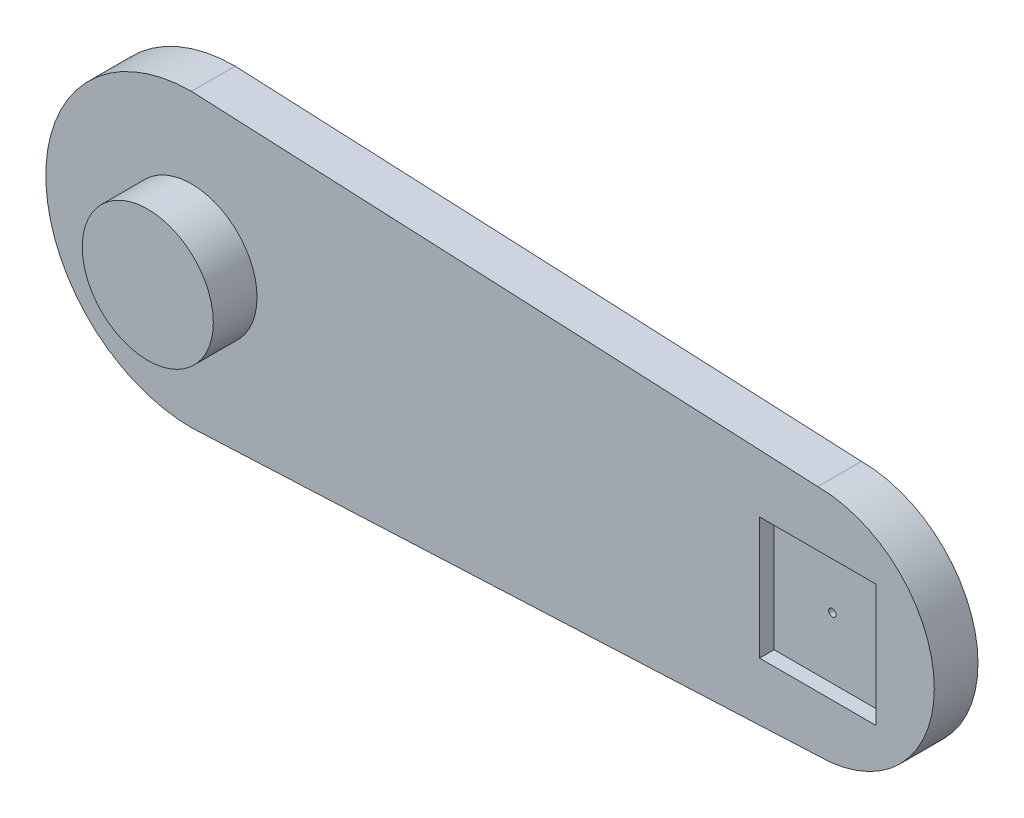
from build123d import *

# Parameters (mm, degrees)
CROQUIS1_R              = 1.25
SALIENTE_EXTRUIR1_DEPTH = 15
CROQUIS4_R              = 22.5
SALIENTE_EXTRUIR2_DEPTH = 15
CROQUIS5_R              = 11
CORTAR_EXTRUIR1_DEPTH   = 5
CROQUIS6_W              = 40
CROQUIS6_H              = 42
CORTAR_EXTRUIR2_DEPTH   = 5


with BuildPart() as part:
    # Croquis1 → Saliente-Extruir1 (new body)
    with BuildSketch(Plane.XY):
        with BuildLine():
            Line((0, -50), (215, -40))
            ThreePointArc((215, -40), (255, 0), (215, 40))
            Line((215, 40), (0, 50))
            ThreePointArc((0, 50), (-50, 0), (0, -50))
        make_face()
        Circle(CROQUIS1_R, mode=Mode.SUBTRACT)
        with Locations((215, 0)):
            Circle(CROQUIS1_R, mode=Mode.SUBTRACT)
    extrude(amount=SALIENTE_EXTRUIR1_DEPTH)

    # Croquis4 → Saliente-Extruir2 (add)
    with BuildSketch(Plane.XY.offset(15)):
        Circle(CROQUIS4_R)
    extrude(amount=SALIENTE_EXTRUIR2_DEPTH)

    # Croquis5 → Cortar-Extruir1 (cut)
    with BuildSketch(Plane(origin=(0, 0, 0), x_dir=(-1, 0, 0), z_dir=(0, 0, -1))):
        Circle(CROQUIS5_R)
    extrude(amount=-CORTAR_EXTRUIR1_DEPTH, mode=Mode.SUBTRACT)

    # Croquis6 → Cortar-Extruir2 (cut)
    with BuildSketch(Plane.XY.offset(15)):
        with Locations((215, 0)):
            Rectangle(CROQUIS6_W, CROQUIS6_H)
    extrude(amount=-CORTAR_EXTRUIR2_DEPTH, mode=Mode.SUBTRACT)


solid = part.part
